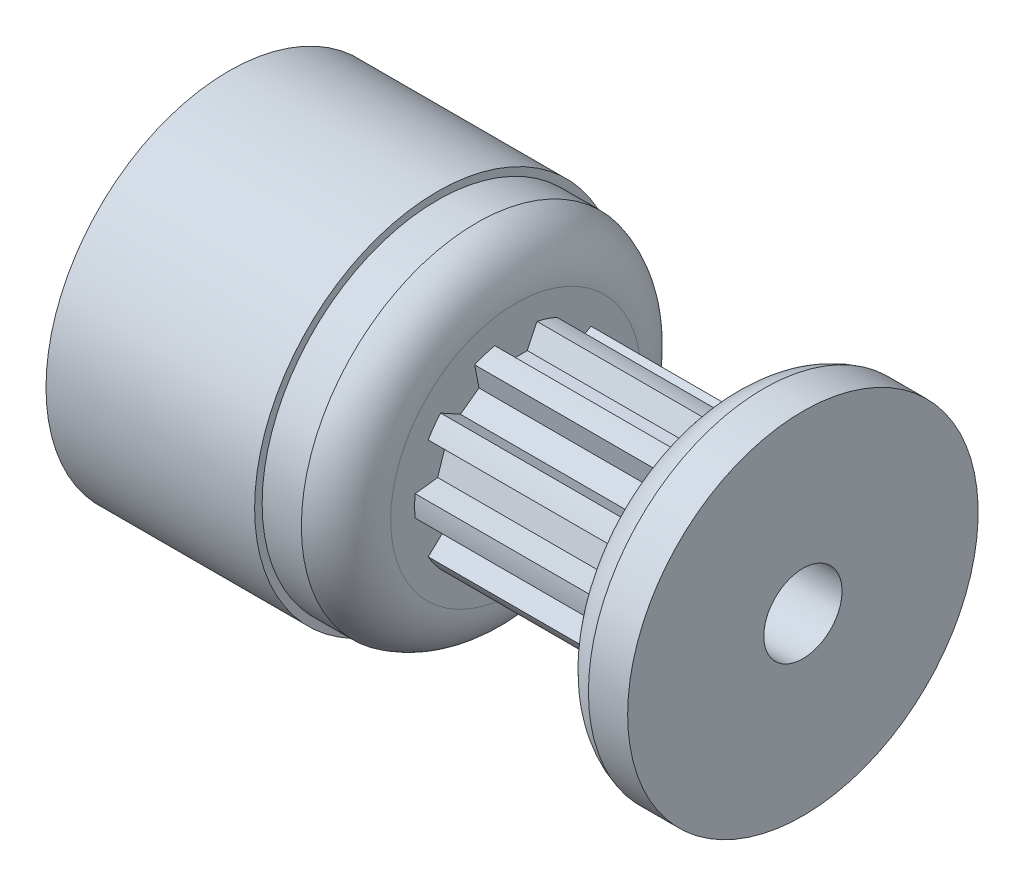
from build123d import *

# Parameters (mm, degrees)
SKETCH4_R          = 3.2385
SKETCH4_R_2        = 3.07975
CUT_EXTRUDE2_DEPTH = 6.35
CUT_EXTRUDE1_DEPTH = 6.35
CIRPATTERN1_COUNT  = 10


with BuildPart() as part:
    # Sketch1 → Revolve1 (revolve)
    with BuildSketch(Plane.XY, mode=Mode.PRIVATE) as revolve1_sk:
        with BuildLine():
            Line((-8.7376, 1.190625), (8.7376, 1.190625))
            Line((8.7376, 1.190625), (8.7376, 5.334))
            Line((8.7376, 5.334), (7.5438, 5.334))
            ThreePointArc((7.5438, 5.334), (6.683980881, 4.77795331), (6.35, 3.81))
            Line((6.35, 3.81), (6.35, 3.2385))
            Line((6.35, 3.2385), (0, 3.2385))
            Line((0, 3.2385), (0, 3.81))
            ThreePointArc((0, 3.81), (-0.333980881, 4.77795331), (-1.1938, 5.334))
            Line((-1.1938, 5.334), (-2.3876, 5.334))
            Line((-2.3876, 5.334), (-2.3876, 5.5626))
            Line((-2.3876, 5.5626), (-8.7376, 5.5626))
            Line((-8.7376, 5.5626), (-8.7376, 1.190625))
        make_face()
    revolve(revolve1_sk.sketch.rotate(Axis((-8.7376, 0, 0), (1, 0, 0)), 90), axis=Axis((-8.7376, 0, 0), (1, 0, 0)))

    # Sketch4 → Cut-Extrude2 (cut)
    with BuildSketch(Plane(origin=(0, 0, 0), x_dir=(0, 0, -1), z_dir=(1, 0, 0))):
        Circle(SKETCH4_R)
        Circle(SKETCH4_R_2, mode=Mode.SUBTRACT)
    extrude(amount=CUT_EXTRUDE2_DEPTH, mode=Mode.SUBTRACT)

    # Sketch3 → Cut-Extrude1 (cut)
    with BuildSketch(Plane(origin=(0, 0, 0), x_dir=(0, 0, -1), z_dir=(1, 0, 0))):
        with BuildLine():
            Line((-0.640454656, 3.012420604), (-0.349102168, 2.387613176))
            Line((-0.349102168, 2.387613176), (0.349102168, 2.387613176))
            Line((0.349102168, 2.387613176), (0.640454656, 3.012420604))
            ThreePointArc((0.640454656, 3.012420604), (0, 3.07975), (-0.640454656, 3.012420604))
        make_face()
    cut_extrude1 = extrude(amount=CUT_EXTRUDE1_DEPTH, mode=Mode.SUBTRACT)

    # CirPattern1: Cut-Extrude1 ×10 about axis
    cirpattern1_axis = Axis((0, 0, 0), (1, 0, 0))
    for i in range(1, CIRPATTERN1_COUNT):
        add(cut_extrude1.rotate(cirpattern1_axis, i * 360 / CIRPATTERN1_COUNT), mode=Mode.SUBTRACT)


solid = part.part
